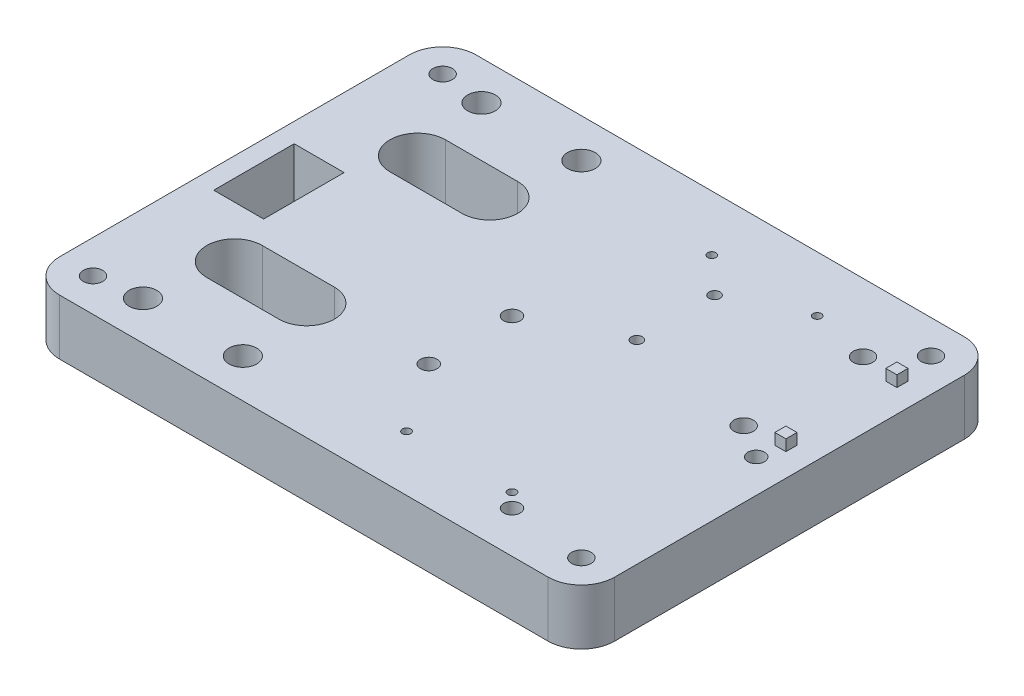
from build123d import *

# Parameters (mm, degrees)
SKETCH_1_W          = 100
SKETCH_1_H          = 75
SKETCH_1_R          = 1.75
SKETCH_1_R_2        = 1.25
SKETCH_1_R_3        = 0.75
SKETCH_1_R_4        = 1.5
SKETCH_1_W_2        = 9
SKETCH_1_H_2        = 14.5
EXTRUDE_1_DEPTH     = 10
FILLET_5_R          = 6
CUT_EXTRUDE_1_REACH = 127.399
SKETCH_2_R          = 1.5
SKETCH_2_R_2        = 1.75
SKETCH_2_R_3        = 1
SKETCH_3_R          = 2.5
CUT_EXTRUDE_2_DEPTH = 7
SKETCH_4_W          = 2
SKETCH_4_H          = 2
EXTRUDE_2_DEPTH     = 2


with BuildPart() as part:
    # Эскиз1 → Бобышка-Вытянуть1 (new body)
    with BuildSketch(Plane(origin=(0, 0, 0), x_dir=(1, 0, 0), z_dir=(0, 1, 0))):
        with Locations((50, 37.5)):
            Rectangle(SKETCH_1_W, SKETCH_1_H)
        with Locations(Location((6, 69, 0), (0, 0, 270))):
            Circle(SKETCH_1_R, mode=Mode.SUBTRACT)
        with Locations(Location((94, 69, 0), (0, 0, 90))):
            Circle(SKETCH_1_R, mode=Mode.SUBTRACT)
        with Locations(Location((94, 6, 0), (0, 0, 270))):
            Circle(SKETCH_1_R, mode=Mode.SUBTRACT)
        with Locations(Location((6, 6, 0), (0, 0, 90))):
            Circle(SKETCH_1_R, mode=Mode.SUBTRACT)
        with Locations(Location((14, 68, 0), (0, 0, 270))):
            Circle(SKETCH_1_R_2, mode=Mode.SUBTRACT)
        with Locations(Location((32, 68, 0), (0, 0, 90))):
            Circle(SKETCH_1_R_2, mode=Mode.SUBTRACT)
        with Locations(Location((32, 7, 0), (0, 0, 270))):
            Circle(SKETCH_1_R_2, mode=Mode.SUBTRACT)
        with Locations(Location((14, 7, 0), (0, 0, 90))):
            Circle(SKETCH_1_R_2, mode=Mode.SUBTRACT)
        with Locations(Location((58.5, 65, 0), (0, 0, 270))):
            Circle(SKETCH_1_R_3, mode=Mode.SUBTRACT)
        with Locations(Location((77.5, 65, 0), (0, 0, 90))):
            Circle(SKETCH_1_R_3, mode=Mode.SUBTRACT)
        with Locations(Location((77.5, 10, 0), (0, 0, 270))):
            Circle(SKETCH_1_R_3, mode=Mode.SUBTRACT)
        with Locations(Location((58.5, 10, 0), (0, 0, 90))):
            Circle(SKETCH_1_R_3, mode=Mode.SUBTRACT)
        with Locations(Location((94, 37.5, 0), (0, 0, 270))):
            Circle(SKETCH_1_R_4, mode=Mode.SUBTRACT)
        with BuildLine():
            Line((16.5, 59), (29.5, 59))
            ThreePointArc((29.5, 59), (34.5, 54), (29.5, 49))
            Line((29.5, 49), (16.5, 49))
            ThreePointArc((16.5, 49), (11.5, 54), (16.5, 59))
        make_face(mode=Mode.SUBTRACT)
        with BuildLine():
            Line((16.5, 16), (29.5, 16))
            ThreePointArc((29.5, 16), (34.5, 21), (29.5, 26))
            Line((29.5, 26), (16.5, 26))
            ThreePointArc((16.5, 26), (11.5, 21), (16.5, 16))
        make_face(mode=Mode.SUBTRACT)
        with Locations((8, 37.5)):
            Rectangle(SKETCH_1_W_2, SKETCH_1_H_2, mode=Mode.SUBTRACT)
    extrude(amount=EXTRUDE_1_DEPTH)

    # Скругление5
    fillet_5_edges = [part.edges().sort_by_distance(p)[0] for p in [
        (0, 5, -75),
        (100, 5, -75),
        (100, 5, 0),
        (0, 5, 0),
    ]]
    fillet(fillet_5_edges, radius=FILLET_5_R)

    # Эскиз2 → Вырез-Вытянуть1 (cut, up to next)
    with BuildSketch(Plane.XZ, mode=Mode.PRIVATE) as cut_extrude_1_sk1:
        with Locations(Location((80, -7.5, 0), (0, 0, 270))):
            Circle(SKETCH_2_R)
    cut_extrude_1_tool1 = extrude(cut_extrude_1_sk1.sketch, amount=-CUT_EXTRUDE_1_REACH, mode=Mode.PRIVATE) & part.part
    # Эскиз2 → Вырез-Вытянуть1 (cut, up to next)
    with BuildSketch(Plane.XZ, mode=Mode.PRIVATE) as cut_extrude_1_sk2:
        with Locations(Location((50, -37.5, 0), (0, 0, 270))):
            Circle(SKETCH_2_R)
    cut_extrude_1_tool2 = extrude(cut_extrude_1_sk2.sketch, amount=-CUT_EXTRUDE_1_REACH, mode=Mode.PRIVATE) & part.part
    # Эскиз2 → Вырез-Вытянуть1 (cut, up to next)
    with BuildSketch(Plane.XZ, mode=Mode.PRIVATE) as cut_extrude_1_sk3:
        with Locations(Location((88, -62.75, 0), (0, 0, 270))):
            Circle(SKETCH_2_R_2)
    cut_extrude_1_tool3 = extrude(cut_extrude_1_sk3.sketch, amount=-CUT_EXTRUDE_1_REACH, mode=Mode.PRIVATE) & part.part
    # Эскиз2 → Вырез-Вытянуть1 (cut, up to next)
    with BuildSketch(Plane.XZ, mode=Mode.PRIVATE) as cut_extrude_1_sk4:
        with Locations(Location((88, -41.25, 0), (0, 0, 270))):
            Circle(SKETCH_2_R_2)
    cut_extrude_1_tool4 = extrude(cut_extrude_1_sk4.sketch, amount=-CUT_EXTRUDE_1_REACH, mode=Mode.PRIVATE) & part.part
    # Эскиз2 → Вырез-Вытянуть1 (cut, up to next)
    with BuildSketch(Plane.XZ, mode=Mode.PRIVATE) as cut_extrude_1_sk5:
        with Locations(Location((50, -22.5, 0), (0, 0, 270))):
            Circle(SKETCH_2_R)
    cut_extrude_1_tool5 = extrude(cut_extrude_1_sk5.sketch, amount=-CUT_EXTRUDE_1_REACH, mode=Mode.PRIVATE) & part.part
    # Эскиз2 → Вырез-Вытянуть1 (cut, up to next)
    with BuildSketch(Plane.XZ, mode=Mode.PRIVATE) as cut_extrude_1_sk6:
        with Locations(Location((65, -59, 0), (0, 0, 270))):
            Circle(SKETCH_2_R_3)
    cut_extrude_1_tool6 = extrude(cut_extrude_1_sk6.sketch, amount=-CUT_EXTRUDE_1_REACH, mode=Mode.PRIVATE) & part.part
    # Эскиз2 → Вырез-Вытянуть1 (cut, up to next)
    with BuildSketch(Plane.XZ, mode=Mode.PRIVATE) as cut_extrude_1_sk7:
        with Locations(Location((65, -45, 0), (0, 0, 270))):
            Circle(SKETCH_2_R_3)
    cut_extrude_1_tool7 = extrude(cut_extrude_1_sk7.sketch, amount=-CUT_EXTRUDE_1_REACH, mode=Mode.PRIVATE) & part.part
    add(cut_extrude_1_tool1.solids().sort_by_distance((80, 0, -7.5))[0], mode=Mode.SUBTRACT)
    add(cut_extrude_1_tool2.solids().sort_by_distance((50, 0, -37.5))[0], mode=Mode.SUBTRACT)
    add(cut_extrude_1_tool3.solids().sort_by_distance((88, 0, -62.75))[0], mode=Mode.SUBTRACT)
    add(cut_extrude_1_tool4.solids().sort_by_distance((88, 0, -41.25))[0], mode=Mode.SUBTRACT)
    add(cut_extrude_1_tool5.solids().sort_by_distance((50, 0, -22.5))[0], mode=Mode.SUBTRACT)
    add(cut_extrude_1_tool6.solids().sort_by_distance((65, 0, -59))[0], mode=Mode.SUBTRACT)
    add(cut_extrude_1_tool7.solids().sort_by_distance((65, 0, -45))[0], mode=Mode.SUBTRACT)

    # Эскиз3 → Вырез-Вытянуть2 (cut)
    with BuildSketch(Plane(origin=(0, 10, 0), x_dir=(1, 0, 0), z_dir=(0, 1, 0))):
        with Locations(Location((14, 68, 0), (0, 0, 270))):
            Circle(SKETCH_3_R)
        with Locations(Location((32, 68, 0), (0, 0, 270))):
            Circle(SKETCH_3_R)
        with Locations(Location((14, 7, 0), (0, 0, 270))):
            Circle(SKETCH_3_R)
        with Locations(Location((32, 7, 0), (0, 0, 270))):
            Circle(SKETCH_3_R)
    extrude(amount=-CUT_EXTRUDE_2_DEPTH, mode=Mode.SUBTRACT)

    # Эскиз4 → Бобышка-Вытянуть2 (add)
    with BuildSketch(Plane(origin=(0, 10, 0), x_dir=(1, 0, 0), z_dir=(0, 1, 0))):
        with Locations((94.855745834, 42)):
            Rectangle(SKETCH_4_W, SKETCH_4_H)
        with Locations((94.855745834, 62)):
            Rectangle(SKETCH_4_W, SKETCH_4_H)
    extrude(amount=EXTRUDE_2_DEPTH)


solid = part.part
